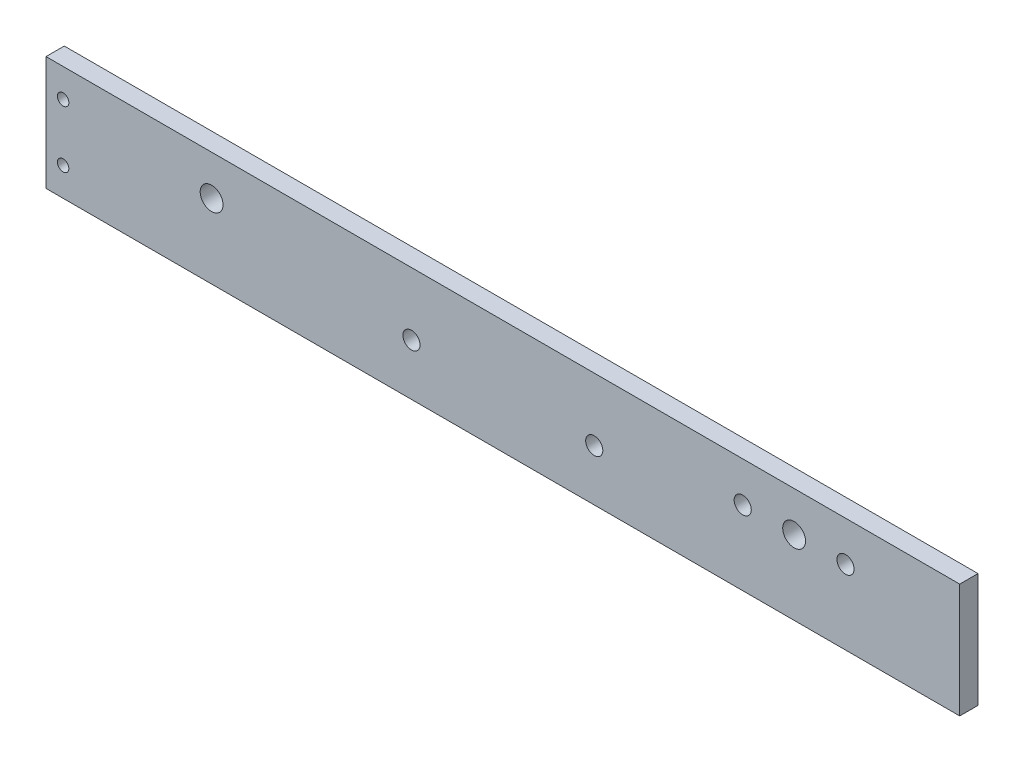
from build123d import *

# Parameters (mm, degrees)
SKETCH2_W               = 160
SKETCH2_H               = 20
BOSS_EXTRUDE1_DEPTH     = 3.2
CUT_EXTRUDE1_DEPTH      = 162.276904732
CUT_EXTRUDE1_DEPTH_BACK = 162.276904732
SKETCH5_R               = 2
SKETCH6_R               = 1.5
CUT_EXTRUDE2_DEPTH      = 10
CUT_EXTRUDE3_DEPTH      = 162.276904732
CUT_EXTRUDE3_DEPTH_BACK = 162.276904732
SKETCH7_R               = 1
SKETCH8_R               = 1.5
CUT_EXTRUDE4_DEPTH      = 10


with BuildPart() as part:
    # Sketch2 → Boss-Extrude1 (new body)
    with BuildSketch(Plane(origin=(0, -10, 10), x_dir=(1, 0, 0), z_dir=(0, 0, -1))):
        with Locations((80, 0)):
            Rectangle(SKETCH2_W, SKETCH2_H)
    extrude(amount=BOSS_EXTRUDE1_DEPTH)

    # Sketch5 → Cut-Extrude1 (cut, two sides: drawn at the far end of the back side and taken through both)
    with BuildSketch(Plane.XY.offset(10).offset(-CUT_EXTRUDE1_DEPTH_BACK)):
        with Locations((131, -7)):
            Circle(SKETCH5_R)
        with Locations((29, -7)):
            Circle(SKETCH5_R)
    extrude(amount=CUT_EXTRUDE1_DEPTH + CUT_EXTRUDE1_DEPTH_BACK, mode=Mode.SUBTRACT)

    # Sketch6 → Cut-Extrude2 (cut)
    with BuildSketch(Plane.XY.offset(10)):
        with Locations((96, -11)):
            Circle(SKETCH6_R)
        with Locations((64, -11)):
            Circle(SKETCH6_R)
    extrude(amount=-CUT_EXTRUDE2_DEPTH, mode=Mode.SUBTRACT)

    # Sketch7 → Cut-Extrude3 (cut, two sides: drawn at the far end of the back side and taken through both)
    with BuildSketch(Plane.XY.offset(10).offset(-CUT_EXTRUDE3_DEPTH_BACK)):
        with Locations((3, -15)):
            Circle(SKETCH7_R)
        with Locations((3, -5)):
            Circle(SKETCH7_R)
    extrude(amount=CUT_EXTRUDE3_DEPTH + CUT_EXTRUDE3_DEPTH_BACK, mode=Mode.SUBTRACT)

    # Sketch8 → Cut-Extrude4 (cut)
    with BuildSketch(Plane.XY.offset(10)):
        with Locations((140, -7)):
            Circle(SKETCH8_R)
        with Locations((122, -7)):
            Circle(SKETCH8_R)
    extrude(amount=-CUT_EXTRUDE4_DEPTH, mode=Mode.SUBTRACT)


solid = part.part
